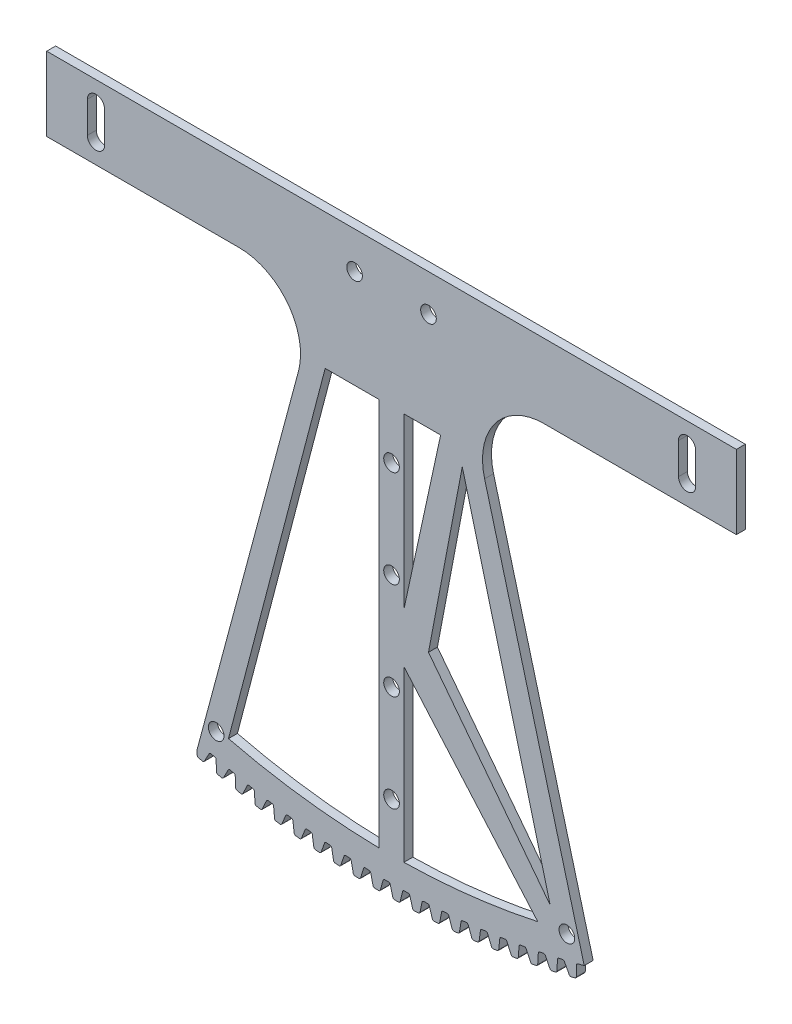
from build123d import *

# Parameters (mm, degrees)
BOSS_EXTRUDE2_DEPTH      = 3.628571429
FILLET1_R                = 25
BOSS_EXTRUDE4_DEPTH      = 3.628571429
CUT_EXTRUDE2_DEPTH       = 336.434355024
FILLET2_R                = 0.73
CIRPATTERN8_COUNT        = 20
CIRPATTERN8_ANGLE        = 28.5
FILLET2_OF_CIRPATTERN8_R = 0.73
SKETCH5_R                = 3.175
CUT_EXTRUDE3_DEPTH       = 338.740034815
SKETCH17_R               = 3.175
CUT_EXTRUDE4_DEPTH       = 338.740034815
FILLET3_R                = 0.7
CUT_EXTRUDE5_DEPTH       = 338.740034815


with BuildPart() as part:
    # Sketch3 → Boss-Extrude2 (new body)
    with BuildSketch(Plane.XY):
        with BuildLine():
            Line((-140, -79.56), (-140, -109.56))
            Line((-140, -109.56), (-29.356513523, -109.56))
            Line((-29.356513523, -109.56), (-78.888044947, -294.414191853))
            ThreePointArc((-78.888044947, -294.414191853), (0, -304.8), (78.888044947, -294.414191853))
            Line((78.888044947, -294.414191853), (29.356513523, -109.56))
            Line((29.356513523, -109.56), (140, -109.56))
            Line((140, -109.56), (140, -79.56))
            Line((140, -79.56), (-140, -79.56))
        make_face()
    extrude(amount=BOSS_EXTRUDE2_DEPTH)

    # Fillet1
    fillet1_edges = [part.edges().sort_by_distance(p)[0] for p in [
        (29.356513523, -109.56, 1.814285714),
        (-29.356513523, -109.56, 1.814285714),
    ]]
    fillet(fillet1_edges, radius=FILLET1_R)

    # Sketch14 → Boss-Extrude4 (add)
    with BuildSketch(Plane(origin=(0, 0, 0), x_dir=(-1, 0, 0), z_dir=(0, 0, -1))):
        with BuildLine():
            Line((78.910933272, -297.036934084), (78.888044947, -294.414191853))
            ThreePointArc((78.888044947, -294.414191853), (76.959432674, -294.924203351), (75.027523715, -295.421581279))
            Line((75.027523715, -295.421581279), (76.289081309, -297.721097125))
            Line((76.289081309, -297.721097125), (78.910933272, -297.036934084))
        make_face()
    boss_extrude4 = extrude(amount=-BOSS_EXTRUDE4_DEPTH)

    # Sketch16 → Cut-Extrude2 (cut, symmetric)
    with BuildSketch(Plane(origin=(0, 0, 0), x_dir=(-1, 0, 0), z_dir=(0, 0, -1))):
        Polygon((372.937709596, -838.440145613), (75.027523715, -295.421581279), (73.765262731, -293.12078332), (71.19993834, -293.754449124), (71.154137831, -296.378353915), (60.344615656, -915.654378233), (357.400151379, -2118.250141136), (669.993245319, -2041.035908516), align=None)
    cut_extrude2 = extrude(amount=CUT_EXTRUDE2_DEPTH, both=True, mode=Mode.SUBTRACT)

    # Fillet2
    fillet2_edges = [part.edges().sort_by_distance(p)[0] for p in [
        (-76.289081309, -297.721097125, 1.814285714),
        (-78.910933272, -297.036934084, 1.814285714),
    ]]
    fillet(fillet2_edges, radius=FILLET2_R)

    # CirPattern8: Boss-Extrude4, Cut-Extrude2 ×20 about axis
    cirpattern8_axis = Axis((0, 0, 0), (0, 0, 1))
    add([boss_extrude4.rotate(cirpattern8_axis, i * CIRPATTERN8_ANGLE / (CIRPATTERN8_COUNT - 1)) for i in range(1, CIRPATTERN8_COUNT)])
    add([cut_extrude2.rotate(cirpattern8_axis, i * CIRPATTERN8_ANGLE / (CIRPATTERN8_COUNT - 1)) for i in range(1, CIRPATTERN8_COUNT)], mode=Mode.SUBTRACT)

    # Fillet2 of CirPattern8
    fillet2_of_cirpattern8_edges = [part.edges().sort_by_distance(p)[0] for p in [
        (-68.469509176, -299.616090878, 1.814285714),
        (-71.108371997, -299.000794367, 1.814285714),
        (-60.603011462, -301.305742729, 1.814285714),
        (-63.257076596, -300.75973444, 1.814285714),
        (-52.694979472, -302.788894675, 1.814285714),
        (-55.362427954, -302.312548815, 1.814285714),
        (-44.750832974, -304.064530237, 1.814285714),
        (-47.429836669, -303.65817327, 1.814285714),
        (-36.776016491, -305.131775158, 1.814285714),
        (-39.464739344, -304.795685581, 1.814285714),
        (-28.775995563, -305.989898002, 1.814285714),
        (-31.472594858, -305.724306153, 1.814285714),
        (-20.756253006, -306.638310655, 1.814285714),
        (-23.458880627, -306.443398558, 1.814285714),
        (-12.722285149, -307.076568726, 1.814285714),
        (-15.429088851, -306.952469964, 1.814285714),
        (-4.679598073, -307.304371856, 1.814285714),
        (-7.388722748, -307.251171481, 1.814285714),
        (3.366296165, -307.32156392, 1.814285714),
        (0.656707216, -307.339298391, 1.814285714),
        (11.409883312, -307.128133135, 1.814285714),
        (8.701687106, -307.216790299, 1.814285714),
        (19.445650695, -306.724212069, 1.814285714),
        (16.740703294, -306.883731164, 1.814285714),
        (27.468091, -306.110077549, 1.814285714),
        (24.76824624, -306.340349249, 1.814285714),
        (35.471706048, -305.286150472, 1.814285714),
        (32.778814268, -305.587016961, 1.814285714),
        (43.45101056, -304.252995517, 1.814285714),
        (40.766917333, -304.624250596, 1.814285714),
        (51.40053592, -303.011320757, 1.814285714),
        (48.72708079, -303.452709986, 1.814285714),
        (59.31483392, -301.561977174, 1.814285714),
        (56.65384914, -302.073198046, 1.814285714),
        (67.188480496, -299.905958075, 1.814285714),
        (64.541789771, -300.486660225, 1.814285714),
        (75.016079444, -298.044398412, 1.814285714),
        (72.385496683, -298.694183857, 1.814285714),
    ]]
    fillet(fillet2_of_cirpattern8_edges, radius=FILLET2_OF_CIRPATTERN8_R)

    # Sketch5 → Cut-Extrude3 (cut, through all)
    with BuildSketch(Plane(origin=(0, 0, 0), x_dir=(-1, 0, 0), z_dir=(0, 0, -1))):
        with Locations((-15, -94.56)):
            Circle(SKETCH5_R)
        with Locations((15, -94.56)):
            Circle(SKETCH5_R)
        with BuildLine():
            Line((-123.5, -94.56), (-123.5, -100.91))
            ThreePointArc((-123.5, -100.91), (-120, -104.41), (-116.5, -100.91))
            Line((-116.5, -100.91), (-116.5, -94.56))
            Line((-116.5, -94.56), (-116.5, -88.21))
            ThreePointArc((-116.5, -88.21), (-120, -84.71), (-123.5, -88.21))
            Line((-123.5, -88.21), (-123.5, -94.56))
        make_face()
        with BuildLine():
            Line((116.5, -94.56), (116.5, -88.21))
            ThreePointArc((116.5, -88.21), (120, -84.71), (123.5, -88.21))
            Line((123.5, -88.21), (123.5, -94.56))
            Line((123.5, -94.56), (123.5, -100.91))
            ThreePointArc((123.5, -100.91), (120, -104.41), (116.5, -100.91))
            Line((116.5, -100.91), (116.5, -94.56))
        make_face()
    extrude(amount=-CUT_EXTRUDE3_DEPTH, mode=Mode.SUBTRACT)

    # Sketch17 → Cut-Extrude4 (cut, through all)
    with BuildSketch(Plane(origin=(0, 0, 0), x_dir=(-1, 0, 0), z_dir=(0, 0, -1))):
        with BuildLine():
            Line((66.194365296, -284.361242536), (26.937147844, -134.56))
            Line((26.937147844, -134.56), (5, -134.56))
            Line((5, -134.56), (5, -292.259285824))
            ThreePointArc((5, -292.259285824), (35.815557854, -290.00224429), (66.194365296, -284.361242536))
        make_face()
        Polygon((-28.711660115, -141.33134449), (-64.419853025, -277.589898046), (-15, -213.409642912), align=None)
        with BuildLine():
            Line((-5, -223.409642912), (-59.372890863, -285.932066063))
            ThreePointArc((-59.372890863, -285.932066063), (-32.341547535, -290.428544105), (-5, -292.259285824))
            Line((-5, -292.259285824), (-5, -223.409642912))
        make_face()
        Polygon((-19.937147844, -134.56), (-5, -203.409642912), (-5, -134.56), align=None)
        with Locations((0, -272.546875096)):
            Circle(SKETCH17_R)
        with Locations((0, -233.12205364)):
            Circle(SKETCH17_R)
        with Locations((0, -193.697232184)):
            Circle(SKETCH17_R)
        with Locations((0, -154.272410728)):
            Circle(SKETCH17_R)
        with Locations((-71.194365296, -284.361242536)):
            Circle(SKETCH17_R)
        with Locations((71.194365296, -284.361242536)):
            Circle(SKETCH17_R)
    extrude(amount=-CUT_EXTRUDE4_DEPTH, mode=Mode.SUBTRACT)

    # Fillet3
    fillet3_edges = [part.edges().sort_by_distance(p)[0] for p in [
        (75.038974367, -292.797301774, 1.814285714),
        (69.922119576, -294.061226268, 1.814285714),
        (67.348720552, -294.661258804, 1.814285714),
        (62.200533493, -295.790806539, 1.814285714),
        (59.612309287, -296.323269727, 1.814285714),
        (54.436318271, -297.317666568, 1.814285714),
        (51.835042724, -297.782195482, 1.814285714),
        (46.634795115, -298.640759918, 1.814285714),
        (44.022251011, -299.037036194, 1.814285714),
        (38.801310801, -299.75917981, 1.814285714),
        (36.179288646, -300.08693186, 1.814285714),
        (30.941234006, -300.672159732, 1.814285714),
        (28.311530805, -300.931162932, 1.814285714),
        (23.059951635, -301.379073976, 1.814285714),
        (20.424369654, -301.569150817, 1.814285714),
        (15.162865125, -301.879438056, 1.814285714),
        (12.52321066, -302.000458269, 1.814285714),
        (7.255386744, -302.172909049, 1.814285714),
        (4.613468884, -302.224789693, 1.814285714),
        (-0.657064116, -302.259285824, 1.814285714),
        (-3.299434734, -302.241991342, 1.814285714),
        (-8.569064657, -302.138509182, 1.814285714),
        (-11.210077084, -302.052051428, 1.814285714),
        (-16.475192389, -301.810661899, 1.814285714),
        (-19.113036607, -301.655100125, 1.814285714),
        (-24.370028848, -301.275968663, 1.814285714),
        (-27.002897009, -301.051409485, 1.814285714),
        (-32.248163305, -300.534795928, 1.814285714),
        (-34.874250975, -300.241393247, 1.814285714),
        (-40.104196483, -299.587651655, 1.814285714),
        (-42.721703871, -299.225606555, 1.814285714),
        (-47.932744248, -298.435184971, 1.814285714),
        (-50.539877446, -298.004745579, 1.814285714),
        (-55.728441303, -297.078185719, 1.814285714),
        (-58.323413512, -296.579647036, 1.814285714),
        (-63.485944869, -295.517583917, 1.814285714),
        (-66.066977625, -294.951287618, 1.814285714),
        (-71.19993834, -293.754449124, 1.814285714),
        (-73.765262731, -293.12078332, 1.814285714),
    ]]
    fillet(fillet3_edges, radius=FILLET3_R)

    # Sketch18 → Cut-Extrude5 (cut, through all)
    with BuildSketch(Plane.XY.offset(3.628571429)):
        with BuildLine():
            Line((78.230653441, -291.960737878), (79.311037365, -294.45428269))
            Line((79.311037365, -294.45428269), (78.618991414, -294.558089583))
            Line((78.618991414, -294.558089583), (77.595784531, -292.13011112))
            ThreePointArc((77.595784531, -292.13011112), (77.91326501, -292.045597014), (78.230653441, -291.960737878))
        make_face()
    extrude(amount=-CUT_EXTRUDE5_DEPTH, mode=Mode.SUBTRACT)


solid = part.part
